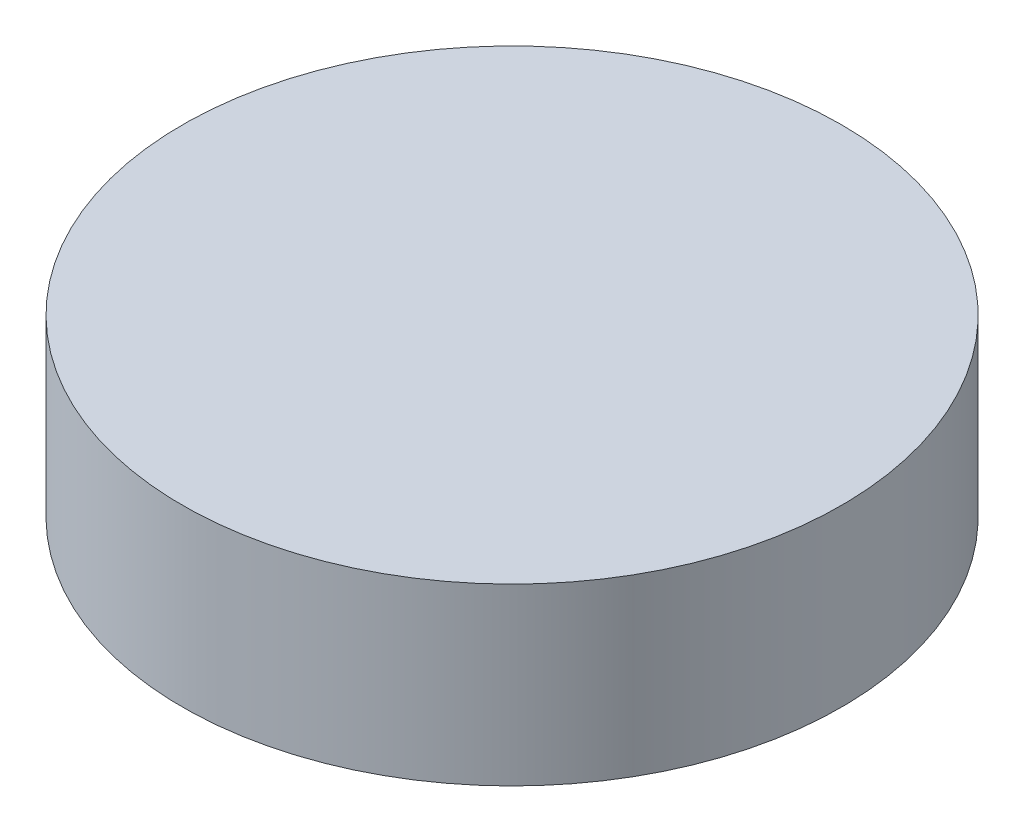
from build123d import *

# Parameters (mm, degrees)
ESBO_O1_R                = 28.75
RESSALTO_EXTRUS_O1_DEPTH = 15.25
CASCA1_T                 = -3


with BuildPart() as part:
    # Esboço1 → Ressalto-extrusão1 (new body)
    with BuildSketch(Plane(origin=(0, 0, 0), x_dir=(1, 0, 0), z_dir=(0, 1, 0))):
        with Locations(Location((0, 0, 0), (0, 0, 90))):
            Circle(ESBO_O1_R)
    extrude(amount=RESSALTO_EXTRUS_O1_DEPTH)

    # Casca1
    casca1_openings = [part.faces().sort_by_distance(p)[0] for p in [
        (0, 0, 0),
    ]]
    offset(amount=CASCA1_T, openings=casca1_openings, kind=Kind.INTERSECTION)


solid = part.part
